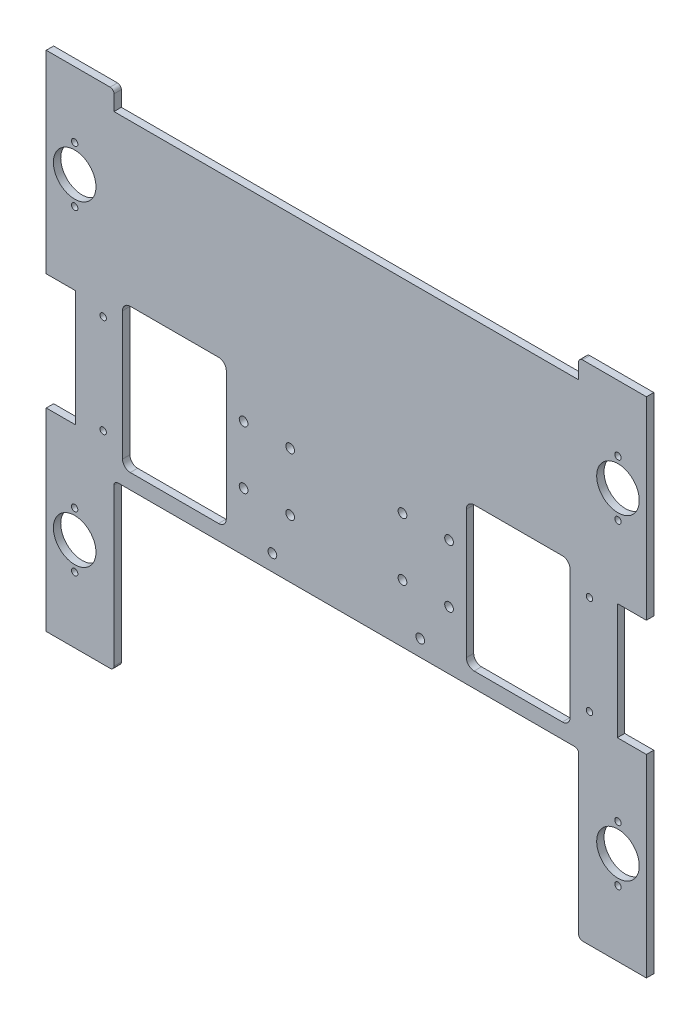
from build123d import *

# Parameters (mm, degrees)
SKETCH2_R           = 1.65
SKETCH2_R_2         = 11
SKETCH2_R_3         = 2.25
BOSS_EXTRUDE1_DEPTH = 3.8


with BuildPart() as part:
    # Sketch2 → Boss-Extrude1 (new body)
    with BuildSketch(Plane.XY):
        with BuildLine():
            Line((-155, 155), (-122, 155))
            ThreePointArc((-122, 155), (-120.585786438, 154.414213562), (-120, 153))
            Line((-120, 153), (-120, 145.072545974))
            Line((-120, 145.072545974), (120, 145.072545974))
            Line((120, 145.072545974), (120, 153))
            ThreePointArc((120, 153), (120.585786438, 154.414213562), (122, 155))
            Line((122, 155), (155, 155))
            Line((155, 155), (155, 55))
            Line((155, 55), (140, 55))
            Line((140, 55), (140, -5))
            Line((140, -5), (155, -5))
            Line((155, -5), (155, -105))
            Line((155, -105), (122, -105))
            ThreePointArc((122, -105), (120.585786438, -104.414213562), (120, -103))
            Line((120, -103), (120, -22))
            ThreePointArc((120, -22), (119.414213562, -20.585786438), (118, -20))
            Line((118, -20), (-118, -20))
            ThreePointArc((-118, -20), (-119.414213562, -20.585786438), (-120, -22))
            Line((-120, -22), (-120, -103))
            ThreePointArc((-120, -103), (-120.585786438, -104.414213562), (-122, -105))
            Line((-122, -105), (-155, -105))
            Line((-155, -105), (-155, -5))
            Line((-155, -5), (-140, -5))
            Line((-140, -5), (-140, 55))
            Line((-140, 55), (-155, 55))
            Line((-155, 55), (-155, 155))
        make_face()
        with Locations(Location((-140.309773495, 121.076789794, 0), (0, 0, 180))):
            Circle(SKETCH2_R, mode=Mode.SUBTRACT)
        with Locations(Location((-140.309773495, 92.407184142, 0), (0, 0, 180))):
            Circle(SKETCH2_R, mode=Mode.SUBTRACT)
        with Locations(Location((140.309773495, 121.076789794, 0), (0, 0, 180))):
            Circle(SKETCH2_R, mode=Mode.SUBTRACT)
        with Locations(Location((140.309773495, 92.407184142, 0), (0, 0, 180))):
            Circle(SKETCH2_R, mode=Mode.SUBTRACT)
        with Locations(Location((140.309773495, 106.741986968, 0), (0, 0, 180))):
            Circle(SKETCH2_R_2, mode=Mode.SUBTRACT)
        with Locations(Location((-140.309773495, 106.741986968, 0), (0, 0, 180))):
            Circle(SKETCH2_R_2, mode=Mode.SUBTRACT)
        with Locations(Location((125.59774802, -0.5, 0), (0, 0, 180))):
            Circle(SKETCH2_R, mode=Mode.SUBTRACT)
        with Locations(Location((125.59774802, 50.5, 0), (0, 0, 180))):
            Circle(SKETCH2_R, mode=Mode.SUBTRACT)
        with Locations(Location((-125.59774802, -0.5, 0), (0, 0, 180))):
            Circle(SKETCH2_R, mode=Mode.SUBTRACT)
        with Locations(Location((-125.59774802, 50.5, 0), (0, 0, 180))):
            Circle(SKETCH2_R, mode=Mode.SUBTRACT)
        with Locations(Location((-29, 10.055, 0), (0, 0, 180))):
            Circle(SKETCH2_R_3, mode=Mode.SUBTRACT)
        with Locations(Location((-29, 39.945, 0), (0, 0, 180))):
            Circle(SKETCH2_R_3, mode=Mode.SUBTRACT)
        with Locations(Location((-53.06, 39.945, 0), (0, 0, 180))):
            Circle(SKETCH2_R_3, mode=Mode.SUBTRACT)
        with Locations(Location((-53.06, 10.055, 0), (0, 0, 180))):
            Circle(SKETCH2_R_3, mode=Mode.SUBTRACT)
        with Locations(Location((53.06, 10.055, 0), (0, 0, 180))):
            Circle(SKETCH2_R_3, mode=Mode.SUBTRACT)
        with Locations(Location((29, 10.055, 0), (0, 0, 180))):
            Circle(SKETCH2_R_3, mode=Mode.SUBTRACT)
        with Locations(Location((29, 39.945, 0), (0, 0, 180))):
            Circle(SKETCH2_R_3, mode=Mode.SUBTRACT)
        with Locations(Location((53.06, 39.945, 0), (0, 0, 180))):
            Circle(SKETCH2_R_3, mode=Mode.SUBTRACT)
        with Locations(Location((140.309773495, -71.076789794, 0), (0, 0, 180))):
            Circle(SKETCH2_R, mode=Mode.SUBTRACT)
        with Locations(Location((140.309773495, -42.407184142, 0), (0, 0, 180))):
            Circle(SKETCH2_R, mode=Mode.SUBTRACT)
        with Locations(Location((140.309773495, -56.741986968, 0), (0, 0, 180))):
            Circle(SKETCH2_R_2, mode=Mode.SUBTRACT)
        with Locations(Location((-140.309773495, -56.741986968, 0), (0, 0, 180))):
            Circle(SKETCH2_R_2, mode=Mode.SUBTRACT)
        with Locations(Location((-140.309773495, -42.407184142, 0), (0, 0, 180))):
            Circle(SKETCH2_R, mode=Mode.SUBTRACT)
        with Locations(Location((-140.309773495, -71.076789794, 0), (0, 0, 180))):
            Circle(SKETCH2_R, mode=Mode.SUBTRACT)
        with Locations(Location((38.179918963, -11.563765186, 0), (0, 0, 180))):
            Circle(SKETCH2_R_3, mode=Mode.SUBTRACT)
        with Locations(Location((-38.179918963, -11.563765186, 0), (0, 0, 180))):
            Circle(SKETCH2_R_3, mode=Mode.SUBTRACT)
        with BuildLine():
            Line((-66, 62.171403079), (-111.59774802, 62.171403079))
            ThreePointArc((-111.59774802, 62.171403079), (-114.426175145, 60.999830204), (-115.59774802, 58.171403079))
            Line((-115.59774802, 58.171403079), (-115.59774802, -8.171403079))
            ThreePointArc((-115.59774802, -8.171403079), (-114.426175145, -10.999830204), (-111.59774802, -12.171403079))
            Line((-111.59774802, -12.171403079), (-66, -12.171403079))
            ThreePointArc((-66, -12.171403079), (-63.171572875, -10.999830204), (-62, -8.171403079))
            Line((-62, -8.171403079), (-62, 58.171403079))
            ThreePointArc((-62, 58.171403079), (-63.171572875, 60.999830204), (-66, 62.171403079))
        make_face(mode=Mode.SUBTRACT)
        with BuildLine():
            Line((66, 62.171403079), (111.59774802, 62.171403079))
            ThreePointArc((111.59774802, 62.171403079), (114.426175145, 60.999830204), (115.59774802, 58.171403079))
            Line((115.59774802, 58.171403079), (115.59774802, -8.171403079))
            ThreePointArc((115.59774802, -8.171403079), (114.426175145, -10.999830204), (111.59774802, -12.171403079))
            Line((111.59774802, -12.171403079), (66, -12.171403079))
            ThreePointArc((66, -12.171403079), (63.171572875, -10.999830204), (62, -8.171403079))
            Line((62, -8.171403079), (62, 58.171403079))
            ThreePointArc((62, 58.171403079), (63.171572875, 60.999830204), (66, 62.171403079))
        make_face(mode=Mode.SUBTRACT)
    extrude(amount=BOSS_EXTRUDE1_DEPTH)


solid = part.part
